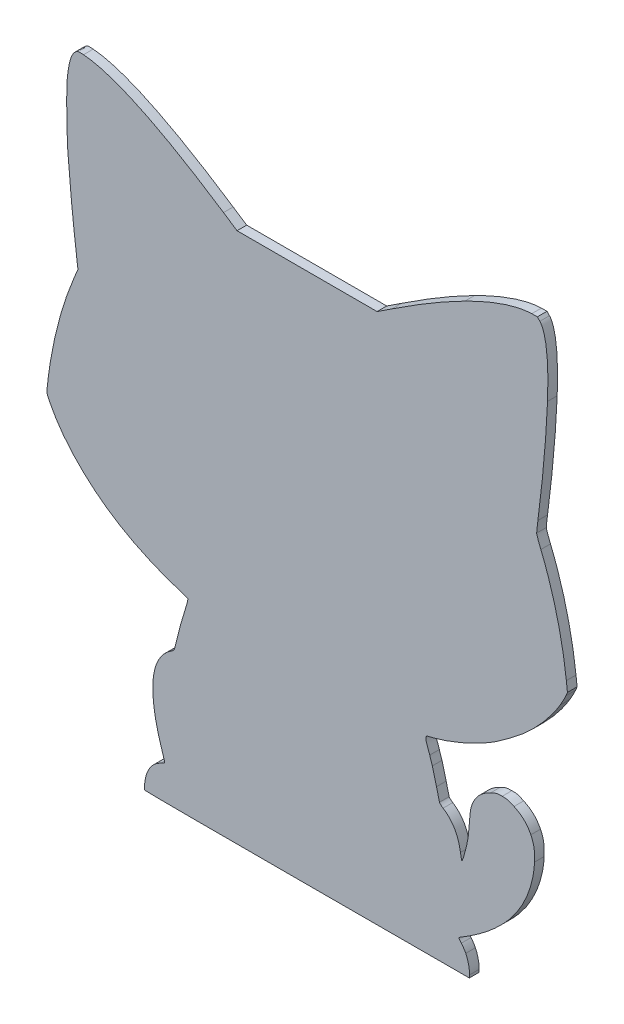
from build123d import *

# Parameters (mm, degrees)
BOSS_EXTRUDE1_DEPTH = 1.5748


with BuildPart() as part:
    # Layer_3_board_outline → Boss-Extrude1 (new body)
    with BuildSketch(Plane.XY):
        with BuildLine():
            Line((10.905279, 66.989376), (11.565916, 68.57587))
            Line((11.565916, 68.57587), (11.468519, 69.345144))
            add(Edge.make_bspline(
                [(11.468519, 69.345144), (10.762407, 74.922248), (10.35118, 78.936711), (9.913897, 84.521611)],
                knots=[0, 0, 0, 0, 1, 1, 1, 1], degree=3))
            add(Edge.make_bspline(
                [(9.913897, 84.521611), (9.734929, 86.807357), (9.666512, 92.814899), (9.801352, 94.403804)],
                knots=[0, 0, 0, 0, 1, 1, 1, 1], degree=3))
            add(Edge.make_bspline(
                [(9.801352, 94.403804), (10.02992, 97.097144), (10.512328, 98.664406), (11.269532, 99.173676)],
                knots=[0, 0, 0, 0, 1, 1, 1, 1], degree=3))
            add(Edge.make_bspline(
                [(11.269532, 99.173676), (11.601946, 99.397247), (11.707074, 99.413118), (12.478233, 99.356153)],
                knots=[0, 0, 0, 0, 1, 1, 1, 1], degree=3))
            add(Edge.make_bspline(
                [(12.478233, 99.356153), (17.256815, 99.003159), (24.956174, 95.335275), (35.30958, 88.47957)],
                knots=[0, 0, 0, 0, 1, 1, 1, 1], degree=3))
            Line((35.30958, 88.47957), (37.516572, 87.018165))
            Line((37.516572, 87.018165), (48.935587, 87.018165))
            Line((48.935587, 87.018165), (60.354599, 87.018165))
            Line((60.354599, 87.018165), (62.780049, 88.611344))
            add(Edge.make_bspline(
                [(62.780049, 88.611344), (67.619549, 91.790215), (70.977768, 93.778896), (74.6716, 95.653322)],
                knots=[0, 0, 0, 0, 1, 1, 1, 1], degree=3))
            add(Edge.make_bspline(
                [(74.6716, 95.653322), (79.31296, 98.008572), (83.102275, 99.286048), (85.574518, 99.328981)],
                knots=[0, 0, 0, 0, 1, 1, 1, 1], degree=3))
            Line((85.574518, 99.328981), (86.491225, 99.3449))
            Line((86.491225, 99.3449), (86.89402, 98.914114))
            add(Edge.make_bspline(
                [(86.89402, 98.914114), (87.939337, 97.796151), (88.385, 94.009848), (88.151152, 88.233632)],
                knots=[0, 0, 0, 0, 1, 1, 1, 1], degree=3))
            add(Edge.make_bspline(
                [(88.151152, 88.233632), (87.944115, 83.11966), (87.363992, 76.622167), (86.579832, 70.63453)],
                knots=[0, 0, 0, 0, 1, 1, 1, 1], degree=3))
            add(Edge.make_bspline(
                [(86.579832, 70.63453), (86.467438, 69.77634), (86.375194, 68.923729), (86.374841, 68.739839)],
                knots=[0, 0, 0, 0, 1, 1, 1, 1], degree=3))
            add(Edge.make_bspline(
                [(86.374841, 68.739839), (86.374528, 68.55595), (86.681254, 67.668103), (87.056549, 66.766847)],
                knots=[0, 0, 0, 0, 1, 1, 1, 1], degree=3))
            add(Edge.make_bspline(
                [(87.056549, 66.766847), (89.06572, 61.941892), (90.602016, 55.87501), (91.219154, 50.328572)],
                knots=[0, 0, 0, 0, 1, 1, 1, 1], degree=3))
            Line((91.219154, 50.328572), (91.395157, 48.746766))
            Line((91.395157, 48.746766), (91.158584, 48.163894))
            add(Edge.make_bspline(
                [(91.158584, 48.163894), (91.028469, 47.843309), (90.597775, 47.033784), (90.201485, 46.364946)],
                knots=[0, 0, 0, 0, 1, 1, 1, 1], degree=3))
            add(Edge.make_bspline(
                [(90.201485, 46.364946), (88.361154, 43.258932), (85.363691, 40.037497), (82.139624, 37.700695)],
                knots=[0, 0, 0, 0, 1, 1, 1, 1], degree=3))
            add(Edge.make_bspline(
                [(82.139624, 37.700695), (81.555597, 37.27739), (80.788822, 36.720405), (80.435681, 36.462948)],
                knots=[0, 0, 0, 0, 1, 1, 1, 1], degree=3))
            add(Edge.make_bspline(
                [(80.435681, 36.462948), (79.381071, 35.694086), (78.286838, 35.037787), (76.864555, 34.321054)],
                knots=[0, 0, 0, 0, 1, 1, 1, 1], degree=3))
            add(Edge.make_bspline(
                [(76.864555, 34.321054), (75.1759, 33.426657), (73.439741, 32.681931), (71.652174, 32.055407)],
                knots=[0, 0, 0, 0, 1, 1, 1, 1], degree=3))
            Line((71.652174, 32.055407), (70.40526, 31.66322))
            add(Edge.make_bspline(
                [(70.40526, 31.66322), (69.71946, 31.447517), (68.924297, 31.233847), (68.638233, 31.188396)],
                knots=[0, 0, 0, 0, 1, 1, 1, 1], degree=3))
            add(Edge.make_bspline(
                [(68.638233, 31.188396), (67.930353, 31.066509), (68.559582, 29.71932), (68.939994, 28.679023)],
                knots=[0, 0, 0, 0, 1, 1, 1, 1], degree=3))
            add(Edge.make_bspline(
                [(68.939994, 28.679023), (68.968323, 28.455474), (69.224795, 27.818256), (69.364242, 27.360097)],
                knots=[0, 0, 0, 0, 1, 1, 1, 1], degree=3))
            add(Edge.make_bspline(
                [(69.364242, 27.360097), (69.503688, 26.901938), (69.809703, 25.731678), (70.044272, 24.75952)],
                knots=[0, 0, 0, 0, 1, 1, 1, 1], degree=3))
            add(Edge.make_bspline(
                [(70.044272, 24.75952), (70.27884, 23.787362), (70.495628, 22.906783), (70.52602, 22.802673)],
                knots=[0, 0, 0, 0, 1, 1, 1, 1], degree=3))
            add(Edge.make_bspline(
                [(70.52602, 22.802673), (70.556395, 22.698563), (70.822846, 22.457039), (71.118092, 22.265952)],
                knots=[0, 0, 0, 0, 1, 1, 1, 1], degree=3))
            add(Edge.make_bspline(
                [(71.118092, 22.265952), (72.674416, 21.258676), (73.587332, 19.701381), (73.953768, 17.428726)],
                knots=[0, 0, 0, 0, 1, 1, 1, 1], degree=3))
            add(Edge.make_bspline(
                [(73.953768, 17.428726), (74.041223, 16.886305), (74.132569, 16.422716), (74.156758, 16.39853)],
                knots=[0, 0, 0, 0, 1, 1, 1, 1], degree=3))
            add(Edge.make_bspline(
                [(74.156758, 16.39853), (74.315567, 16.239722), (75.0624, 19.008573), (75.23374, 20.391383)],
                knots=[0, 0, 0, 0, 1, 1, 1, 1], degree=3))
            add(Edge.make_bspline(
                [(75.23374, 20.391383), (75.297538, 20.906297), (75.391425, 21.985863), (75.442376, 22.790415)],
                knots=[0, 0, 0, 0, 1, 1, 1, 1], degree=3))
            add(Edge.make_bspline(
                [(75.442376, 22.790415), (75.512283, 23.894367), (75.597485, 24.432891), (75.789671, 24.985517)],
                knots=[0, 0, 0, 0, 1, 1, 1, 1], degree=3))
            add(Edge.make_bspline(
                [(75.789671, 24.985517), (76.322241, 26.516928), (77.268331, 27.537619), (78.863608, 28.301842)],
                knots=[0, 0, 0, 0, 1, 1, 1, 1], degree=3))
            add(Edge.make_bspline(
                [(78.863608, 28.301842), (79.784941, 28.743209), (79.874955, 28.765241), (80.756922, 28.765241)],
                knots=[0, 0, 0, 0, 1, 1, 1, 1], degree=3))
            add(Edge.make_bspline(
                [(80.756922, 28.765241), (81.642439, 28.765241), (81.726732, 28.744367), (82.685458, 28.287234)],
                knots=[0, 0, 0, 0, 1, 1, 1, 1], degree=3))
            add(Edge.make_bspline(
                [(82.685458, 28.287234), (84.018375, 27.651705), (84.844356, 26.859281), (85.424631, 25.659348)],
                knots=[0, 0, 0, 0, 1, 1, 1, 1], degree=3))
            add(Edge.make_bspline(
                [(85.424631, 25.659348), (85.954788, 24.563048), (86.108326, 23.661539), (86.030434, 22.102341)],
                knots=[0, 0, 0, 0, 1, 1, 1, 1], degree=3))
            add(Edge.make_bspline(
                [(86.030434, 22.102341), (85.853147, 18.553438), (84.473302, 15.10284), (82.019869, 12.073053)],
                knots=[0, 0, 0, 0, 1, 1, 1, 1], degree=3))
            add(Edge.make_bspline(
                [(82.019869, 12.073053), (81.160341, 11.011609), (79.56731, 9.455985), (78.288645, 8.429451)],
                knots=[0, 0, 0, 0, 1, 1, 1, 1], degree=3))
            add(Edge.make_bspline(
                [(78.288645, 8.429451), (77.210664, 7.564027), (75.04602, 6.075298), (74.125451, 5.566219)],
                knots=[0, 0, 0, 0, 1, 1, 1, 1], degree=3))
            add(Edge.make_bspline(
                [(74.125451, 5.566219), (73.882297, 5.431755), (73.683353, 5.27708), (73.683353, 5.222499)],
                knots=[0, 0, 0, 0, 1, 1, 1, 1], degree=3))
            add(Edge.make_bspline(
                [(73.683353, 5.222499), (73.683353, 5.167915), (73.867938, 4.923006), (74.09354, 4.678254)],
                knots=[0, 0, 0, 0, 1, 1, 1, 1], degree=3))
            add(Edge.make_bspline(
                [(74.09354, 4.678254), (74.319145, 4.433505), (74.643985, 3.955408), (74.815408, 3.615821)],
                knots=[0, 0, 0, 0, 1, 1, 1, 1], degree=3))
            add(Edge.make_bspline(
                [(74.815408, 3.615821), (75.173012, 2.907414), (75.480233, 1.542503), (75.432386, 0.87473)],
                knots=[0, 0, 0, 0, 1, 1, 1, 1], degree=3))
            Line((75.432386, 0.87473), (75.399723, 0.418953))
            Line((75.399723, 0.418953), (48.969391, 0.392739))
            add(Edge.make_bspline(
                [(48.969391, 0.392739), (34.432711, 0.378314), (22.507766, 0.397836), (22.431486, 0.474134)],
                knots=[0, 0, 0, 0, 1, 1, 1, 1], degree=3))
            add(Edge.make_bspline(
                [(22.431486, 0.474134), (22.355207, 0.550431), (22.390199, 1.233613), (22.55434, 2.091498)],
                knots=[0, 0, 0, 0, 1, 1, 1, 1], degree=3))
            add(Edge.make_bspline(
                [(22.55434, 2.091498), (22.874318, 3.763877), (23.735243, 4.966904), (25.053552, 5.583813)],
                knots=[0, 0, 0, 0, 1, 1, 1, 1], degree=3))
            add(Edge.make_bspline(
                [(25.053552, 5.583813), (25.424905, 5.757594), (25.72874, 5.956378), (25.72874, 6.025564)],
                knots=[0, 0, 0, 0, 1, 1, 1, 1], degree=3))
            add(Edge.make_bspline(
                [(25.72874, 6.025564), (25.72874, 6.09475), (25.563219, 6.640358), (25.360914, 7.238029)],
                knots=[0, 0, 0, 0, 1, 1, 1, 1], degree=3))
            add(Edge.make_bspline(
                [(25.360914, 7.238029), (25.15861, 7.835701), (24.856413, 8.839621), (24.689368, 9.46896)],
                knots=[0, 0, 0, 0, 1, 1, 1, 1], degree=3))
            add(Edge.make_bspline(
                [(24.689368, 9.46896), (22.990708, 15.868606), (23.662401, 20.172796), (26.679496, 22.221666)],
                knots=[0, 0, 0, 0, 1, 1, 1, 1], degree=3))
            add(Edge.make_bspline(
                [(26.679496, 22.221666), (27.343971, 22.672904), (27.270864, 22.510347), (27.751072, 24.604318)],
                knots=[0, 0, 0, 0, 1, 1, 1, 1], degree=3))
            add(Edge.make_bspline(
                [(27.751072, 24.604318), (28.084222, 26.057038), (28.392222, 27.156319), (29.073625, 29.324632)],
                knots=[0, 0, 0, 0, 1, 1, 1, 1], degree=3))
            add(Edge.make_bspline(
                [(29.073625, 29.324632), (29.359095, 30.233034), (29.554162, 31.010322), (29.50711, 31.051942)],
                knots=[0, 0, 0, 0, 1, 1, 1, 1], degree=3))
            add(Edge.make_bspline(
                [(29.50711, 31.051942), (29.460057, 31.093562), (28.719404, 31.350065), (27.861213, 31.621954)],
                knots=[0, 0, 0, 0, 1, 1, 1, 1], degree=3))
            add(Edge.make_bspline(
                [(27.861213, 31.621954), (23.642576, 32.958473), (19.354445, 35.039594), (16.26264, 37.250989)],
                knots=[0, 0, 0, 0, 1, 1, 1, 1], degree=3))
            add(Edge.make_bspline(
                [(16.26264, 37.250989), (12.098574, 40.229312), (8.784186, 43.887051), (7.033061, 47.436693)],
                knots=[0, 0, 0, 0, 1, 1, 1, 1], degree=3))
            add(Edge.make_bspline(
                [(7.033061, 47.436693), (6.489107, 48.539324), (6.470578, 48.604702), (6.531713, 49.205775)],
                knots=[0, 0, 0, 0, 1, 1, 1, 1], degree=3))
            add(Edge.make_bspline(
                [(6.531713, 49.205775), (7.175858, 55.539092), (8.674164, 61.631435), (10.905279, 66.989376)],
                knots=[0, 0, 0, 0, 1, 1, 1, 1], degree=3))
        make_face()
    extrude(amount=BOSS_EXTRUDE1_DEPTH)


solid = part.part
